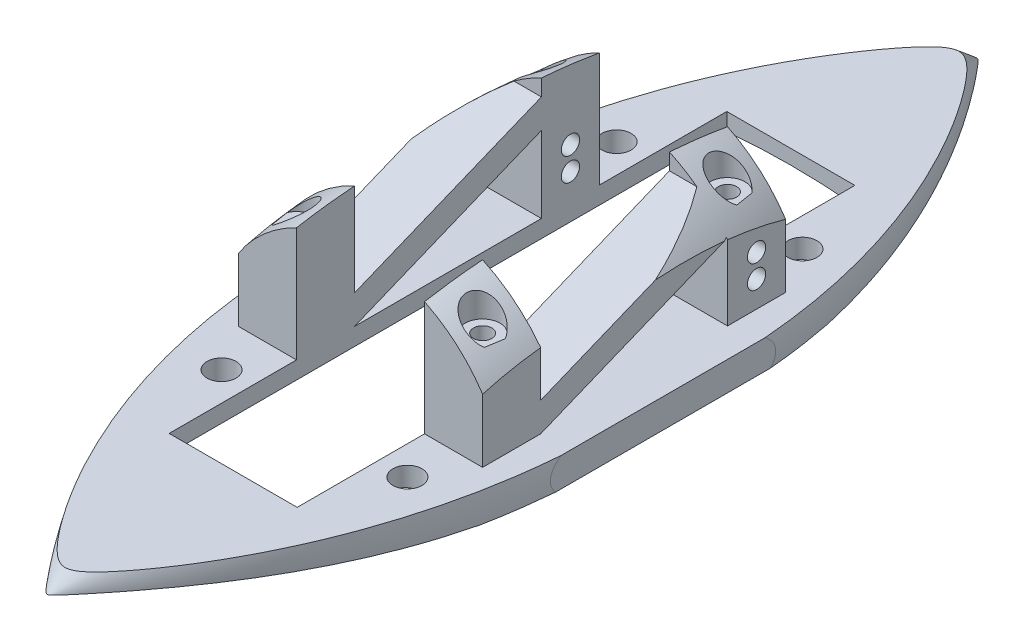
from build123d import *

# Parameters (mm, degrees)
SKETCH2_W                      = 33.02
SKETCH2_H                      = 3.175
BOSS_EXTRUDE1_DEPTH            = 101.6
SKETCH3_R                      = 76.2
CUT_EXTRUDE1_DEPTH             = 103.944937983
SKETCH5_W                      = 6.35
SKETCH5_H                      = 6.35
BOSS_EXTRUDE2_DEPTH            = 15.24
BOSS_EXTRUDE3_DEPTH            = 6.35
CUT_REVOLVE1_ANGLE             = 100
CUT_REVOLVE1_OTHER_WAY_ANGLE   = 100
CUT_EXTRUDE2_REACH             = 105.788
CUT_EXTRUDE2_END_RADIUS        = 76.2
SKETCH7_W                      = 13.9954
SKETCH7_H                      = 60.96
CUT_EXTRUDE3_REACH             = 108.938
SKETCH8_R                      = 1
CUT_EXTRUDE3_DIRECTION_2_DEPTH = 107.937852426
CUT_EXTRUDE4_REACH             = 105.788
CUT_EXTRUDE4_END_RADIUS        = 76.2
SKETCH9_R                      = 1.5875
CUT_EXTRUDE5_REACH             = 115.313
CUT_EXTRUDE5_START             = 9.525
SKETCH11_R                     = 1.905
SKETCH12_R                     = 1
CUT_EXTRUDE6_DEPTH             = 4.445


with BuildPart() as part:
    # Sketch2 → Boss-Extrude1 (new body)
    with BuildSketch(Plane.XY):
        Rectangle(SKETCH2_W, SKETCH2_H)
    extrude(amount=BOSS_EXTRUDE1_DEPTH)

    # Sketch3 → Cut-Extrude1 (cut, through all)
    with BuildSketch(Plane.XY.offset(101.6)):
        with Locations((0, -76.2)):
            Circle(SKETCH3_R)
    extrude(amount=-CUT_EXTRUDE1_DEPTH, mode=Mode.SUBTRACT)

    # Sketch5 → Boss-Extrude2 (add)
    with BuildSketch(Plane(origin=(0, 1.5875, 0), x_dir=(1, 0, 0), z_dir=(0, 1, 0))):
        with Locations((-10.1727, -37.4142)):
            Rectangle(SKETCH5_W, SKETCH5_H)
        with Locations((10.1727, -37.4142)):
            Rectangle(SKETCH5_W, SKETCH5_H)
        with Locations((-10.1727, -64.1858)):
            Rectangle(SKETCH5_W, SKETCH5_H)
        with Locations((10.1727, -64.1858)):
            Rectangle(SKETCH5_W, SKETCH5_H)
    extrude(amount=BOSS_EXTRUDE2_DEPTH)

    # Sketch6 → Boss-Extrude3 (add)
    with BuildSketch(Plane(origin=(13.3477, 0, 0), x_dir=(0, 0, -1), z_dir=(1, 0, 0))):
        Polygon((-61.0108, 1.5875), (-61.0108, 4.7625), (-40.5892, 13.097993592), (-40.5892, 9.922993592), align=None)
    boss_extrude3 = extrude(amount=-BOSS_EXTRUDE3_DEPTH)

    # Mirror4: Boss-Extrude3 across plane
    add(boss_extrude3.mirror(Plane(origin=(0, 0, 0), x_dir=(0, 0, 1), z_dir=(1, 0, 0))))

    # Sketch4 → Cut-Revolve1 (revolve, cut)
    with BuildSketch(Plane(origin=(0, 0, 0), x_dir=(0, 0, -1), z_dir=(1, 0, 0))):
        with BuildLine():
            Line((-48.26, 16.51), (-53.34, 16.51))
            ThreePointArc((-53.34, 16.51), (-79.030872285, 12.817549757), (-101.6, 0))
            Line((-101.6, 0), (-101.6, 25.4))
            Line((-101.6, 25.4), (0, 25.4))
            Line((0, 25.4), (0, 0))
            ThreePointArc((0, 0), (-22.569127715, 12.817549757), (-48.26, 16.51))
        make_face()
    revolve(axis=Axis((0, -0.254, 0), (0, 0, 1)), revolution_arc=CUT_REVOLVE1_ANGLE, mode=Mode.SUBTRACT)

    # Sketch4 → Cut-Revolve1 other way (revolve, cut)
    with BuildSketch(Plane(origin=(0, 0, 0), x_dir=(0, 0, -1), z_dir=(1, 0, 0))):
        with BuildLine():
            Line((-48.26, 16.51), (-53.34, 16.51))
            ThreePointArc((-53.34, 16.51), (-79.030872285, 12.817549757), (-101.6, 0))
            Line((-101.6, 0), (-101.6, 25.4))
            Line((-101.6, 25.4), (0, 25.4))
            Line((0, 25.4), (0, 0))
            ThreePointArc((0, 0), (-22.569127715, 12.817549757), (-48.26, 16.51))
        make_face()
    revolve(axis=Axis((0, -0.254, 0), (0, 0, -1)), revolution_arc=CUT_REVOLVE1_OTHER_WAY_ANGLE, mode=Mode.SUBTRACT)

    # Cut-Extrude2: up to this cylinder (the profile starts outside it)
    cut_extrude2_end = Plane(origin=(0, -76.2, 50.8), z_dir=(0, 0, 1)) * Cylinder(CUT_EXTRUDE2_END_RADIUS, 364.976, mode=Mode.PRIVATE)
    # Sketch7 → Cut-Extrude2 (cut, up to the surface)
    with BuildSketch(Plane(origin=(0, 1.5875, 0), x_dir=(1, 0, 0), z_dir=(0, 1, 0)), mode=Mode.PRIVATE) as cut_extrude2_sk1:
        with Locations((0, -50.8)):
            Rectangle(SKETCH7_W, SKETCH7_H)
    cut_extrude2_tool1 = extrude(cut_extrude2_sk1.sketch, amount=-CUT_EXTRUDE2_REACH, mode=Mode.PRIVATE) - cut_extrude2_end
    add(cut_extrude2_tool1.solids().sort_by_distance((0, 1.5875, 50.8))[0], mode=Mode.SUBTRACT)

    # Cut-Extrude3: up to this face of the body (flat: up to its plane)
    cut_extrude3_end = Plane(part.part.faces().sort_by_distance((-13.3477, 5.415399425, 37.499469611))[0])
    # Sketch8 → Cut-Extrude3 (cut, up to the picked face)
    with BuildSketch(Plane(origin=(13.3477, 0, 0), x_dir=(0, 0, -1), z_dir=(1, 0, 0)), mode=Mode.PRIVATE) as cut_extrude3_sk1:
        with Locations((-37.4142, 6.985)):
            Circle(SKETCH8_R)
    cut_extrude3_tool1 = split(extrude(cut_extrude3_sk1.sketch, amount=-CUT_EXTRUDE3_REACH, mode=Mode.PRIVATE), bisect_by=cut_extrude3_end, keep=Keep.BOTH, mode=Mode.PRIVATE)
    # Sketch8 → Cut-Extrude3 (cut, up to the picked face)
    with BuildSketch(Plane(origin=(13.3477, 0, 0), x_dir=(0, 0, -1), z_dir=(1, 0, 0)), mode=Mode.PRIVATE) as cut_extrude3_sk2:
        with Locations((-37.4142, 4.445)):
            Circle(SKETCH8_R)
    cut_extrude3_tool2 = split(extrude(cut_extrude3_sk2.sketch, amount=-CUT_EXTRUDE3_REACH, mode=Mode.PRIVATE), bisect_by=cut_extrude3_end, keep=Keep.BOTH, mode=Mode.PRIVATE)
    add(cut_extrude3_tool1.solids().sort_by(Axis((13.3477, 6.985, 37.4142), (-1, 0, 0)))[0], mode=Mode.SUBTRACT)
    add(cut_extrude3_tool2.solids().sort_by(Axis((13.3477, 4.445, 37.4142), (-1, 0, 0)))[0], mode=Mode.SUBTRACT)

    # Sketch8 → Cut-Extrude3 direction 2 (cut)
    with BuildSketch(Plane(origin=(13.3477, 0, 0), x_dir=(0, 0, -1), z_dir=(1, 0, 0))):
        with Locations((-37.4142, 6.985)):
            Circle(SKETCH8_R)
        with Locations((-37.4142, 4.445)):
            Circle(SKETCH8_R)
    extrude(amount=CUT_EXTRUDE3_DIRECTION_2_DEPTH, mode=Mode.SUBTRACT)

    # Cut-Extrude4: up to this cylinder (the profile starts outside it)
    cut_extrude4_end = Plane(origin=(0, -76.2, 50.8), z_dir=(0, 0, 1)) * Cylinder(CUT_EXTRUDE4_END_RADIUS, 408.156, mode=Mode.PRIVATE)
    # Sketch9 → Cut-Extrude4 (cut, up to the surface)
    with BuildSketch(Plane(origin=(0, 1.5875, 0), x_dir=(1, 0, 0), z_dir=(0, 1, 0)), mode=Mode.PRIVATE) as cut_extrude4_sk1:
        with Locations(Location((-10.16, -72.39, 0), (0, 0, 270))):
            Circle(SKETCH9_R)
    cut_extrude4_tool1 = extrude(cut_extrude4_sk1.sketch, amount=-CUT_EXTRUDE4_REACH, mode=Mode.PRIVATE) - cut_extrude4_end
    add(cut_extrude4_tool1.solids().sort_by_distance((-10.16, 1.5875, 72.39))[0], mode=Mode.SUBTRACT)
    # Sketch9 → Cut-Extrude4 (cut, up to the surface)
    with BuildSketch(Plane(origin=(0, 1.5875, 0), x_dir=(1, 0, 0), z_dir=(0, 1, 0)), mode=Mode.PRIVATE) as cut_extrude4_sk2:
        with Locations(Location((-10.16, -29.21, 0), (0, 0, 270))):
            Circle(SKETCH9_R)
    cut_extrude4_tool2 = extrude(cut_extrude4_sk2.sketch, amount=-CUT_EXTRUDE4_REACH, mode=Mode.PRIVATE) - cut_extrude4_end
    add(cut_extrude4_tool2.solids().sort_by_distance((-10.16, 1.5875, 29.21))[0], mode=Mode.SUBTRACT)
    # Sketch9 → Cut-Extrude4 (cut, up to the surface)
    with BuildSketch(Plane(origin=(0, 1.5875, 0), x_dir=(1, 0, 0), z_dir=(0, 1, 0)), mode=Mode.PRIVATE) as cut_extrude4_sk3:
        with Locations(Location((10.16, -72.39, 0), (0, 0, 270))):
            Circle(SKETCH9_R)
    cut_extrude4_tool3 = extrude(cut_extrude4_sk3.sketch, amount=-CUT_EXTRUDE4_REACH, mode=Mode.PRIVATE) - cut_extrude4_end
    add(cut_extrude4_tool3.solids().sort_by_distance((10.16, 1.5875, 72.39))[0], mode=Mode.SUBTRACT)
    # Sketch9 → Cut-Extrude4 (cut, up to the surface)
    with BuildSketch(Plane(origin=(0, 1.5875, 0), x_dir=(1, 0, 0), z_dir=(0, 1, 0)), mode=Mode.PRIVATE) as cut_extrude4_sk4:
        with Locations(Location((10.16, -29.21, 0), (0, 0, 270))):
            Circle(SKETCH9_R)
    cut_extrude4_tool4 = extrude(cut_extrude4_sk4.sketch, amount=-CUT_EXTRUDE4_REACH, mode=Mode.PRIVATE) - cut_extrude4_end
    add(cut_extrude4_tool4.solids().sort_by_distance((10.16, 1.5875, 29.21))[0], mode=Mode.SUBTRACT)

    # Sketch11 → Cut-Extrude5 (cut, up to next)
    with BuildSketch(Plane(origin=(0, 1.5875, 0), x_dir=(1, 0, 0), z_dir=(0, 1, 0)).offset(CUT_EXTRUDE5_START), mode=Mode.PRIVATE) as cut_extrude5_sk1:
        with Locations((-10.1727, -37.4142)):
            Circle(SKETCH11_R)
    cut_extrude5_tool1 = extrude(cut_extrude5_sk1.sketch, amount=CUT_EXTRUDE5_REACH, mode=Mode.PRIVATE) & part.part
    # Sketch11 → Cut-Extrude5 (cut, up to next)
    with BuildSketch(Plane(origin=(0, 1.5875, 0), x_dir=(1, 0, 0), z_dir=(0, 1, 0)).offset(CUT_EXTRUDE5_START), mode=Mode.PRIVATE) as cut_extrude5_sk2:
        with Locations((10.1727, -37.4142)):
            Circle(SKETCH11_R)
    cut_extrude5_tool2 = extrude(cut_extrude5_sk2.sketch, amount=CUT_EXTRUDE5_REACH, mode=Mode.PRIVATE) & part.part
    # Sketch11 → Cut-Extrude5 (cut, up to next)
    with BuildSketch(Plane(origin=(0, 1.5875, 0), x_dir=(1, 0, 0), z_dir=(0, 1, 0)).offset(CUT_EXTRUDE5_START), mode=Mode.PRIVATE) as cut_extrude5_sk3:
        with Locations((10.1727, -64.1858)):
            Circle(SKETCH11_R)
    cut_extrude5_tool3 = extrude(cut_extrude5_sk3.sketch, amount=CUT_EXTRUDE5_REACH, mode=Mode.PRIVATE) & part.part
    # Sketch11 → Cut-Extrude5 (cut, up to next)
    with BuildSketch(Plane(origin=(0, 1.5875, 0), x_dir=(1, 0, 0), z_dir=(0, 1, 0)).offset(CUT_EXTRUDE5_START), mode=Mode.PRIVATE) as cut_extrude5_sk4:
        with Locations((-10.1727, -64.1858)):
            Circle(SKETCH11_R)
    cut_extrude5_tool4 = extrude(cut_extrude5_sk4.sketch, amount=CUT_EXTRUDE5_REACH, mode=Mode.PRIVATE) & part.part
    add(cut_extrude5_tool1.solids().sort_by_distance((-10.1727, 11.1125, 37.4142))[0], mode=Mode.SUBTRACT)
    add(cut_extrude5_tool2.solids().sort_by_distance((10.1727, 11.1125, 37.4142))[0], mode=Mode.SUBTRACT)
    add(cut_extrude5_tool3.solids().sort_by_distance((10.1727, 11.1125, 64.1858))[0], mode=Mode.SUBTRACT)
    add(cut_extrude5_tool4.solids().sort_by_distance((-10.1727, 11.1125, 64.1858))[0], mode=Mode.SUBTRACT)

    # Sketch12 → Cut-Extrude6 (cut)
    with BuildSketch(Plane(origin=(0, 11.1125, 0), x_dir=(1, 0, 0), z_dir=(0, 1, 0))):
        with Locations(Location((10.1727, -64.1858, 0), (0, 0, 270))):
            Circle(SKETCH12_R)
        with Locations(Location((-10.1727, -64.1858, 0), (0, 0, 90))):
            Circle(SKETCH12_R)
        with Locations(Location((-10.1727, -37.4142, 0), (0, 0, 270))):
            Circle(SKETCH12_R)
        with Locations(Location((10.1727, -37.4142, 0), (0, 0, 90))):
            Circle(SKETCH12_R)
    extrude(amount=-CUT_EXTRUDE6_DEPTH, mode=Mode.SUBTRACT)


solid = part.part
